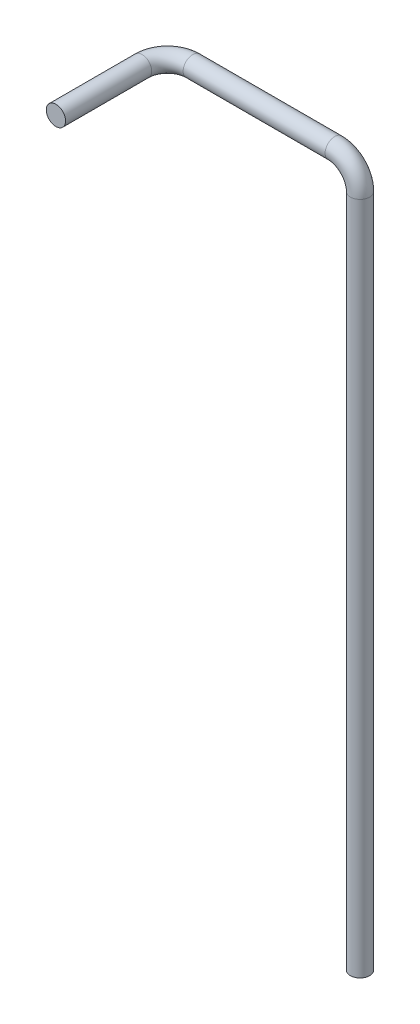
from build123d import *

# Parameters (mm, degrees)
CROQUIS1_R              = 9.525
SALIENTE_EXTRUIR1_DEPTH = 10
CROQUIS2_R              = 9.525


with BuildPart() as part:
    # Croquis1 → Saliente-Extruir1 (new body)
    with BuildSketch(Plane(origin=(0, 0, 0), x_dir=(1, 0, 0), z_dir=(0, 1, 0))):
        with Locations(Location((0, 0, 0), (0, 0, 270))):
            Circle(CROQUIS1_R)
    extrude(amount=SALIENTE_EXTRUIR1_DEPTH)

    # Barrer1: sweep along a curve in space
    with BuildLine() as barrer1_path:
        Line((0, 10, 0), (0, 665, 0))
        ThreePointArc((0, 665, 0), (-7.32233047, 682.67766953, 0), (-25, 690, 0))
        Line((-25, 690, 0), (-165, 690, 0))
        ThreePointArc((-165, 690, 0), (-182.67766953, 690, 7.32233047), (-190, 690, 25))
        Line((-190, 690, 25), (-190, 690, 110))
    # Croquis2 → Barrer1 (sweep)
    with BuildSketch(Plane(origin=(0, 10, 0), x_dir=(1, 0, 0), z_dir=(0, 1, 0))):
        Circle(CROQUIS2_R)
    sweep(path=barrer1_path.line)


solid = part.part
